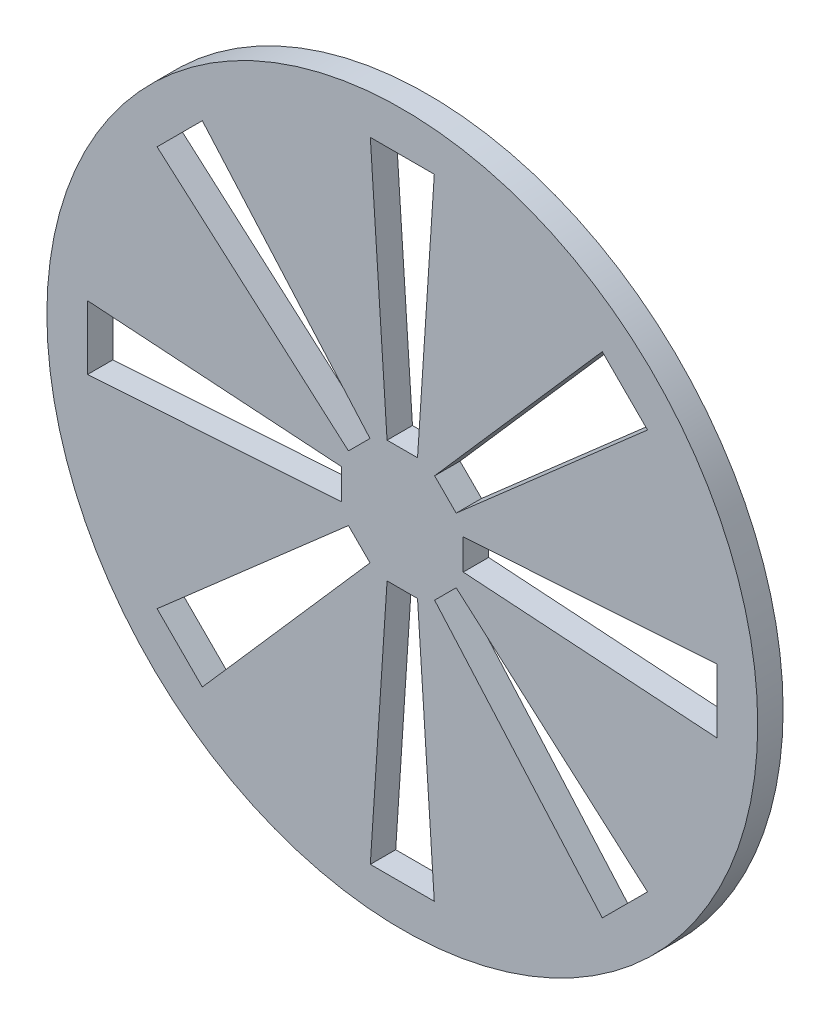
from build123d import *

# Parameters (mm, degrees)
SKETCH1_R           = 35
BOSS_EXTRUDE1_DEPTH = 2.5


with BuildPart() as part:
    # Sketch1 → Boss-Extrude1 (new body)
    with BuildSketch(Plane.XY):
        Circle(SKETCH1_R)
        Polygon((3.15, 31), (-3.15, 31), (-1.5, 6), (1.5, 6), align=None, mode=Mode.SUBTRACT)
        Polygon((19.692923856, 24.147696578), (3.181980515, 5.303300859), (5.303300859, 3.181980515), (24.147696578, 19.692923856), align=None, mode=Mode.SUBTRACT)
        Polygon((31, 3.15), (6, 1.5), (6, -1.5), (31, -3.15), align=None, mode=Mode.SUBTRACT)
        Polygon((24.147696578, -19.692923856), (5.303300859, -3.181980515), (3.181980515, -5.303300859), (19.692923856, -24.147696578), align=None, mode=Mode.SUBTRACT)
        Polygon((3.15, -31), (1.5, -6), (-1.5, -6), (-3.15, -31), align=None, mode=Mode.SUBTRACT)
        Polygon((-19.692923856, -24.147696578), (-3.181980515, -5.303300859), (-5.303300859, -3.181980515), (-24.147696578, -19.692923856), align=None, mode=Mode.SUBTRACT)
        Polygon((-31, -3.15), (-6, -1.5), (-6, 1.5), (-31, 3.15), align=None, mode=Mode.SUBTRACT)
        Polygon((-24.147696578, 19.692923856), (-5.303300859, 3.181980515), (-3.181980515, 5.303300859), (-19.692923856, 24.147696578), align=None, mode=Mode.SUBTRACT)
    extrude(amount=BOSS_EXTRUDE1_DEPTH)


solid = part.part
